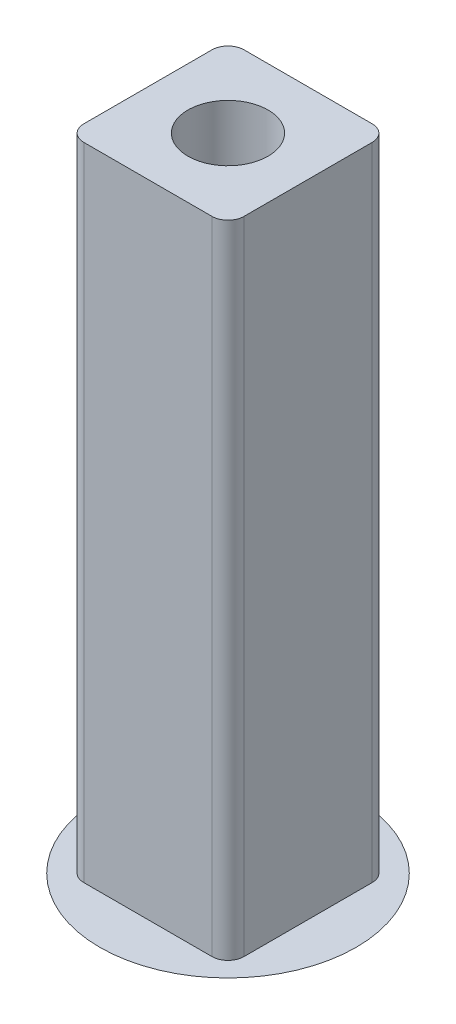
from build123d import *

# Parameters (mm, degrees)
SKETCH_1_R      = 1.25
EXTRUDE_1_DEPTH = 20


with BuildPart() as part:
    # Эскиз1 → Бобышка-Вытянуть1 (new body)
    with BuildSketch(Plane(origin=(0, 0, 0), x_dir=(1, 0, 0), z_dir=(0, 1, 0))):
        with BuildLine():
            Line((-2, -2.5), (2, -2.5))
            ThreePointArc((2, -2.5), (2.353553391, -2.353553391), (2.5, -2))
            Line((2.5, -2), (2.5, 2))
            ThreePointArc((2.5, 2), (2.353553391, 2.353553391), (2, 2.5))
            Line((2, 2.5), (-2, 2.5))
            ThreePointArc((-2, 2.5), (-2.353553391, 2.353553391), (-2.5, 2))
            Line((-2.5, 2), (-2.5, -2))
            ThreePointArc((-2.5, -2), (-2.353553391, -2.353553391), (-2, -2.5))
        make_face()
        with Locations(Location((0, 0, 0), (0, 0, 270))):
            Circle(SKETCH_1_R, mode=Mode.SUBTRACT)
    extrude(amount=EXTRUDE_1_DEPTH)

    # Бобышка-Вытянуть2 cone 1 section (through the dimple's axis) → Бобышка-Вытянуть2 (revolve)
    with BuildSketch(Plane(origin=(0, 0, 0), x_dir=(0, 0, 1), z_dir=(1, 0, 0))):
        Polygon((0, 0), (4, 0), (0, 1.950930354), align=None)
    revolve(axis=Axis((0, 0, 0), (0, -1, 0)))


solid = part.part
